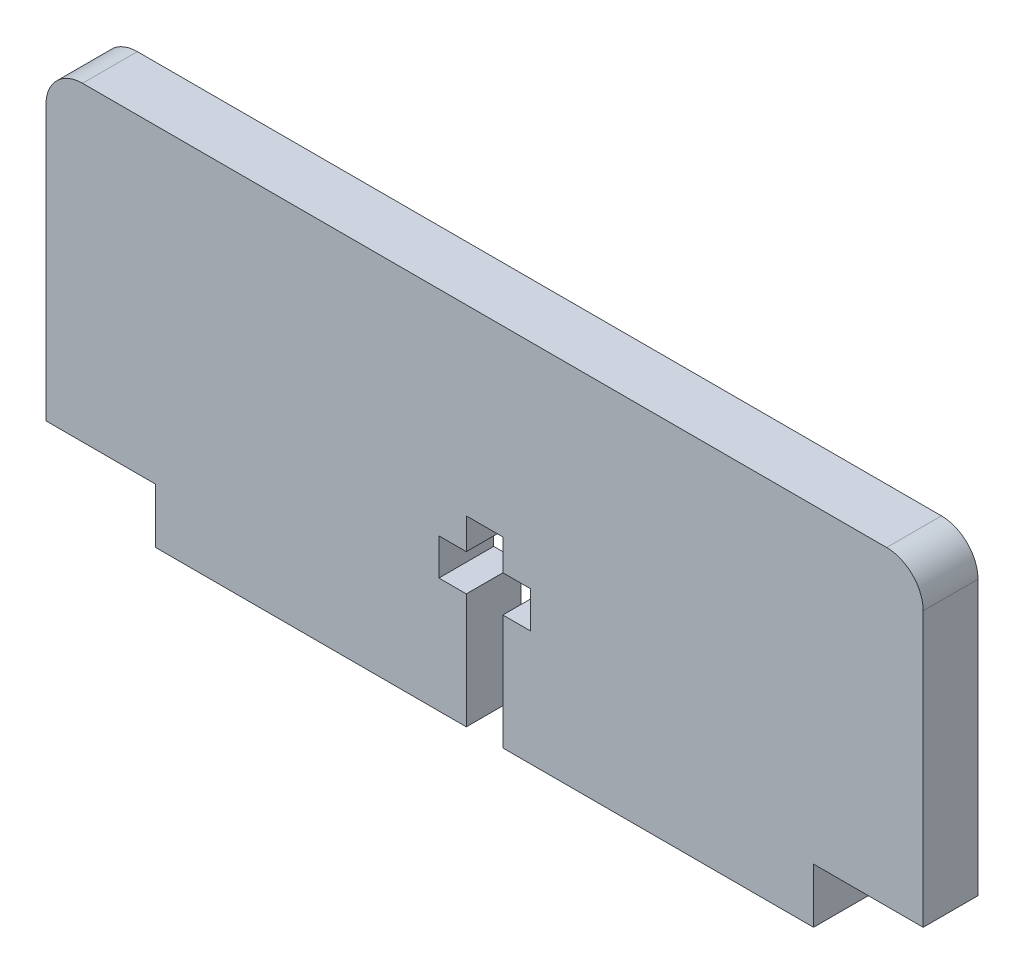
from build123d import *

# Parameters (mm, degrees)
BOSS_EXTRU_1_DEPTH      = 15
ESQUISSE3_W             = 30
ESQUISSE3_H             = 15
ENL_V_MAT_EXTRU_1_DEPTH = 15


with BuildPart() as part:
    # Esquisse2 → Boss.-Extru.1 (new body)
    with BuildSketch(Plane.XY):
        with BuildLine():
            Line((-120, 0), (120, 0))
            Line((120, 0), (120, 15))
            Line((120, 15), (120, 55.414518843))
            Line((120, 55.414518843), (120, 75.414518843))
            Line((120, 75.414518843), (120, 90))
            ThreePointArc((120, 90), (117.071067812, 97.071067812), (110, 100))
            Line((110, 100), (-110, 100))
            ThreePointArc((-110, 100), (-117.071067812, 97.071067812), (-120, 90))
            Line((-120, 90), (-120, 75.414518843))
            Line((-120, 75.414518843), (-120, 55.414518843))
            Line((-120, 55.414518843), (-120, 15))
            Line((-120, 15), (-120, 0))
        make_face()
    extrude(amount=BOSS_EXTRU_1_DEPTH)

    # Esquisse3 → Enlèv. mat.-Extru.1 (cut)
    with BuildSketch(Plane.XY.offset(15)):
        with Locations((-105, 7.5)):
            Rectangle(ESQUISSE3_W, ESQUISSE3_H)
        Polygon((-5, 31.515847226), (-5, 0), (5, 0), (5, 31.515847226), (12.5, 31.515847226), (12.5, 41.515847226), (5, 41.515847226), (5, 50), (-5, 50), (-5, 41.515847226), (-12.5, 41.515847226), (-12.5, 31.515847226), align=None)
        with Locations((105, 7.5)):
            Rectangle(ESQUISSE3_W, ESQUISSE3_H)
    extrude(amount=-ENL_V_MAT_EXTRU_1_DEPTH, mode=Mode.SUBTRACT)


solid = part.part
